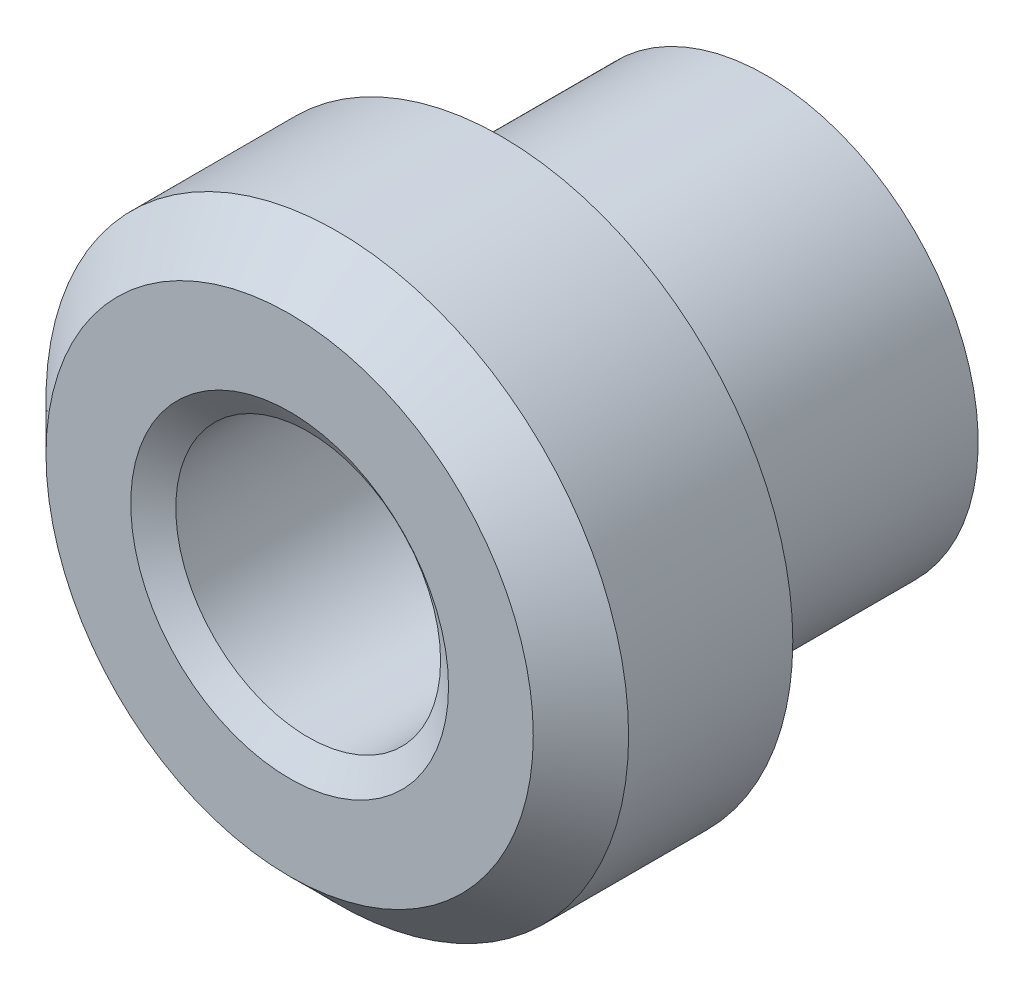
from build123d import *

# Parameters (mm, degrees)
BASENUTSKE_R       = 2.75
BASENUTSKE_R_2     = 1.25
BASENUT_DEPTH      = 4.5
CHAMFER1_SIZE      = 0.45
SKETCH1_OUTSIDE_W  = 9.298
SKETCH1_OUTSIDE_H  = 9.298
SKETCH1_OUTSIDE_R  = 2
CUT_EXTRUDE1_DEPTH = 2.5


with BuildPart() as part:
    # BaseNutSke → BaseNut (new body)
    with BuildSketch(Plane.XY):
        Circle(BASENUTSKE_R)
        Circle(BASENUTSKE_R_2, mode=Mode.SUBTRACT)
    extrude(amount=-BASENUT_DEPTH)

    # EndChSke (on Right Plane) → EndChamfer (revolve, cut)
    with BuildSketch(Plane(origin=(0, 0, 0), x_dir=(0, 0, -1), z_dir=(1, 0, 0)), mode=Mode.PRIVATE) as endchamfer_sk:
        Polygon((4.4746, 1.5), (4.282042927, 1.225), (4.5254, 1.225), (4.5254, 1.5), align=None)
        Polygon((-0.0508, 1.5), (0, 1.5), (0.192557073, 1.225), (-0.0508, 1.225), align=None)
    revolve(endchamfer_sk.sketch.rotate(Axis((0, 0, -25.037505729), (0, 0, -1)), 90), axis=Axis((0, 0, -25.037505729), (0, 0, -1)), mode=Mode.SUBTRACT)

    # Chamfer1
    chamfer1_edges = [part.edges().sort_by_distance(p)[0] for p in [
        (-2.75, 0, 0),
    ]]
    chamfer(chamfer1_edges, length=CHAMFER1_SIZE)

    # Sketch1 outside → Cut-Extrude1 (cut)
    with BuildSketch(Plane(origin=(0, 0, -4.5), x_dir=(-1, 0, 0), z_dir=(0, 0, -1))):
        Rectangle(SKETCH1_OUTSIDE_W, SKETCH1_OUTSIDE_H)
        Circle(SKETCH1_OUTSIDE_R, mode=Mode.SUBTRACT)
    extrude(amount=-CUT_EXTRUDE1_DEPTH, mode=Mode.SUBTRACT)


solid = part.part
